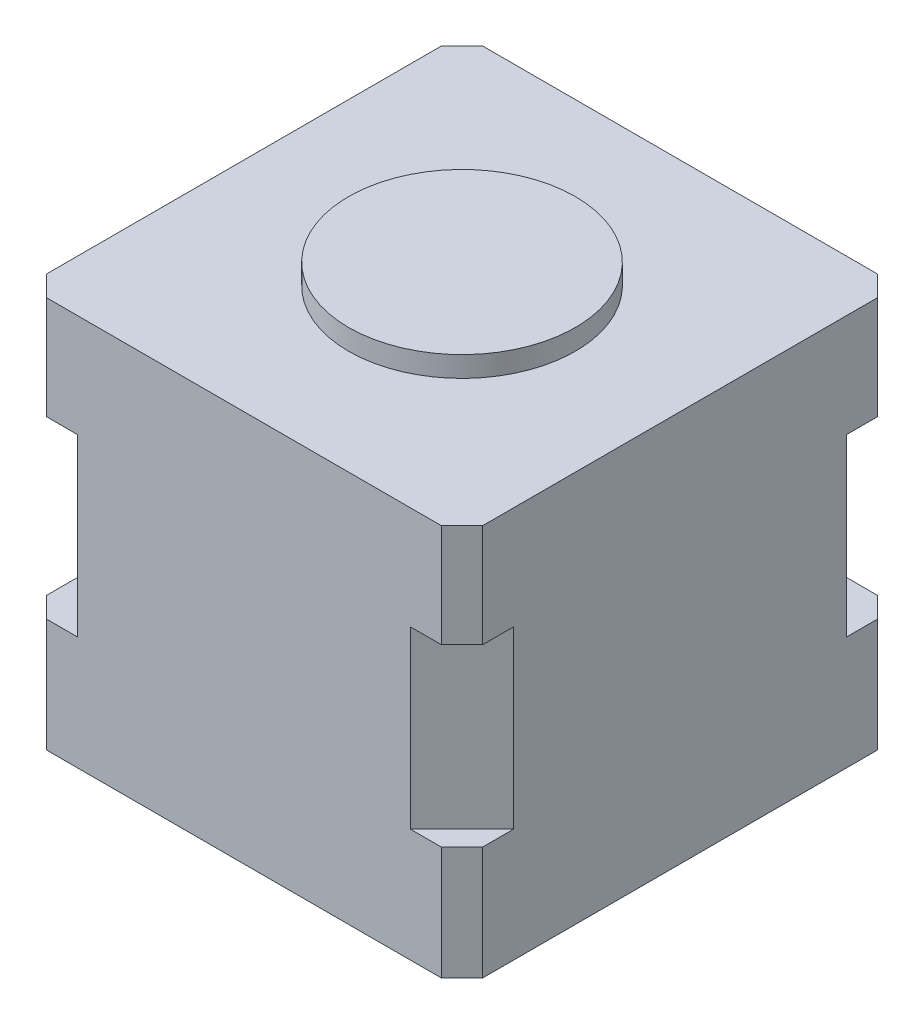
from build123d import *

# Parameters (mm, degrees)
BOSS_EXTRUDE1_DEPTH = 11
BOSS_EXTRUDE2_DEPTH = 17
BOSS_EXTRUDE3_DEPTH = 10
SKETCH4_R           = 11
BOSS_EXTRUDE4_DEPTH = 2


with BuildPart() as part:
    # Sketch1 → Boss-Extrude1 (new body)
    with BuildSketch(Plane(origin=(0, 0, 0), x_dir=(1, 0, 0), z_dir=(0, 1, 0))):
        Polygon((19.15, -21.15), (21.15, -19.15), (21.15, 19.15), (19.15, 21.15), (-19.15, 21.15), (-21.15, 19.15), (-21.15, -19.15), (-19.15, -21.15), align=None)
    extrude(amount=BOSS_EXTRUDE1_DEPTH)

    # Sketch2 → Boss-Extrude2 (add)
    with BuildSketch(Plane(origin=(0, 11, 0), x_dir=(1, 0, 0), z_dir=(0, 1, 0))):
        Polygon((16.15, -21.15), (21.15, -16.15), (21.15, 16.15), (16.15, 21.15), (-16.15, 21.15), (-21.15, 16.15), (-21.15, -16.15), (-16.15, -21.15), align=None)
    extrude(amount=BOSS_EXTRUDE2_DEPTH)

    # Sketch3 → Boss-Extrude3 (add)
    with BuildSketch(Plane(origin=(0, 28, 0), x_dir=(1, 0, 0), z_dir=(0, 1, 0))):
        Polygon((19.15, -21.15), (21.15, -19.15), (21.15, 19.15), (19.15, 21.15), (-19.15, 21.15), (-21.15, 19.15), (-21.15, -19.15), (-19.15, -21.15), align=None)
    extrude(amount=BOSS_EXTRUDE3_DEPTH)

    # Sketch4 → Boss-Extrude4 (add)
    with BuildSketch(Plane(origin=(0, 38, 0), x_dir=(1, 0, 0), z_dir=(0, 1, 0))):
        with Locations(Location((0, 0, 0), (0, 0, 270))):
            Circle(SKETCH4_R)
    extrude(amount=BOSS_EXTRUDE4_DEPTH)


solid = part.part
